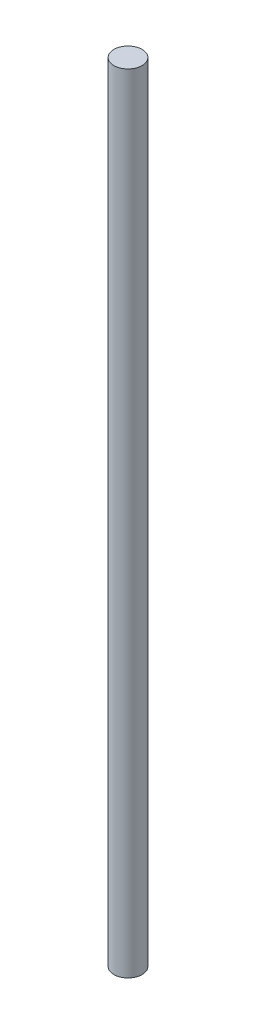
from build123d import *

# Parameters (mm, degrees)
SKETCH1_R           = 2.5
BOSS_EXTRUDE1_DEPTH = 140


with BuildPart() as part:
    # Sketch1 → Boss-Extrude1 (new body)
    with BuildSketch(Plane(origin=(0, 0, 0), x_dir=(1, 0, 0), z_dir=(0, 1, 0))):
        with Locations(Location((0, 0, 0), (0, 0, 270))):
            Circle(SKETCH1_R)
    extrude(amount=BOSS_EXTRUDE1_DEPTH)


solid = part.part
